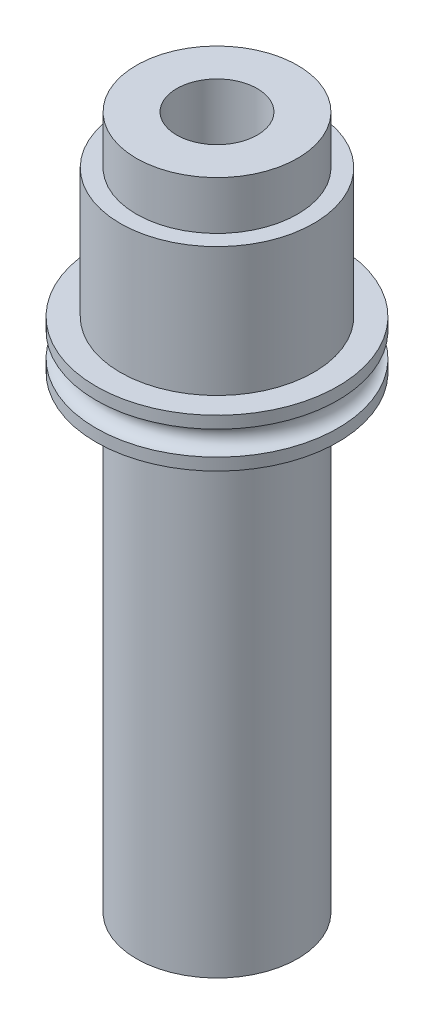
from build123d import *

# Parameters (mm, degrees)
CROQUIS1_R              = 7.5
SALIENTE_EXTRUIR1_DEPTH = 3
CROQUIS2_R              = 0.75
CROQUIS4_R              = 5
SALIENTE_EXTRUIR2_DEPTH = 29
CROQUIS5_R              = 6
SALIENTE_EXTRUIR3_DEPTH = 8
SALIENTE_EXTRUIR4_START = 3
CROQUIS6_R              = 5
SALIENTE_EXTRUIR4_DEPTH = 3
CROQUIS3_R              = 2.5
CORTAR_EXTRUIR1_DEPTH   = 45.288824776


with BuildPart() as part:
    # Croquis1 → Saliente-Extruir1 (new body)
    with BuildSketch(Plane(origin=(0, 0, 0), x_dir=(1, 0, 0), z_dir=(0, 1, 0))):
        with Locations(Location((0, 0, 0), (0, 0, 270))):
            Circle(CROQUIS1_R)
    extrude(amount=SALIENTE_EXTRUIR1_DEPTH)

    # Croquis2 → Cortar-Revolución1 (revolve, cut)
    with BuildSketch(Plane(origin=(0, 0, 0), x_dir=(0, 0, -1), z_dir=(1, 0, 0)), mode=Mode.PRIVATE) as cortar_revoluci_n1_sk:
        with Locations((7.5, 1.5)):
            Circle(CROQUIS2_R)
    revolve(cortar_revoluci_n1_sk.sketch.rotate(Axis((0, 3, 0), (0, -1, 0)), 180), axis=Axis((0, 3, 0), (0, -1, 0)), mode=Mode.SUBTRACT)

    # Croquis4 → Saliente-Extruir2 (add)
    with BuildSketch(Plane.XZ):
        with Locations(Location((0, 0, 0), (0, 0, 90))):
            Circle(CROQUIS4_R)
    extrude(amount=SALIENTE_EXTRUIR2_DEPTH)

    # Croquis5 → Saliente-Extruir3 (add)
    with BuildSketch(Plane(origin=(0, 3, 0), x_dir=(1, 0, 0), z_dir=(0, 1, 0))):
        with Locations(Location((0, 0, 0), (0, 0, 270))):
            Circle(CROQUIS5_R)
    extrude(amount=SALIENTE_EXTRUIR3_DEPTH)

    # Croquis6 → Saliente-Extruir4 (add)
    with BuildSketch(Plane(origin=(0, 11, 0), x_dir=(1, 0, 0), z_dir=(0, 1, 0)).offset(SALIENTE_EXTRUIR4_START)):
        with Locations(Location((0, 0, 0), (0, 0, 270))):
            Circle(CROQUIS6_R)
    extrude(amount=-SALIENTE_EXTRUIR4_DEPTH)

    # Croquis3 → Cortar-Extruir1 (cut, through all)
    with BuildSketch(Plane(origin=(0, -29, 0), x_dir=(1, 0, 0), z_dir=(0, 1, 0))):
        with Locations(Location((0, 0, 0), (0, 0, 270))):
            Circle(CROQUIS3_R)
    extrude(amount=CORTAR_EXTRUIR1_DEPTH, mode=Mode.SUBTRACT)


solid = part.part
